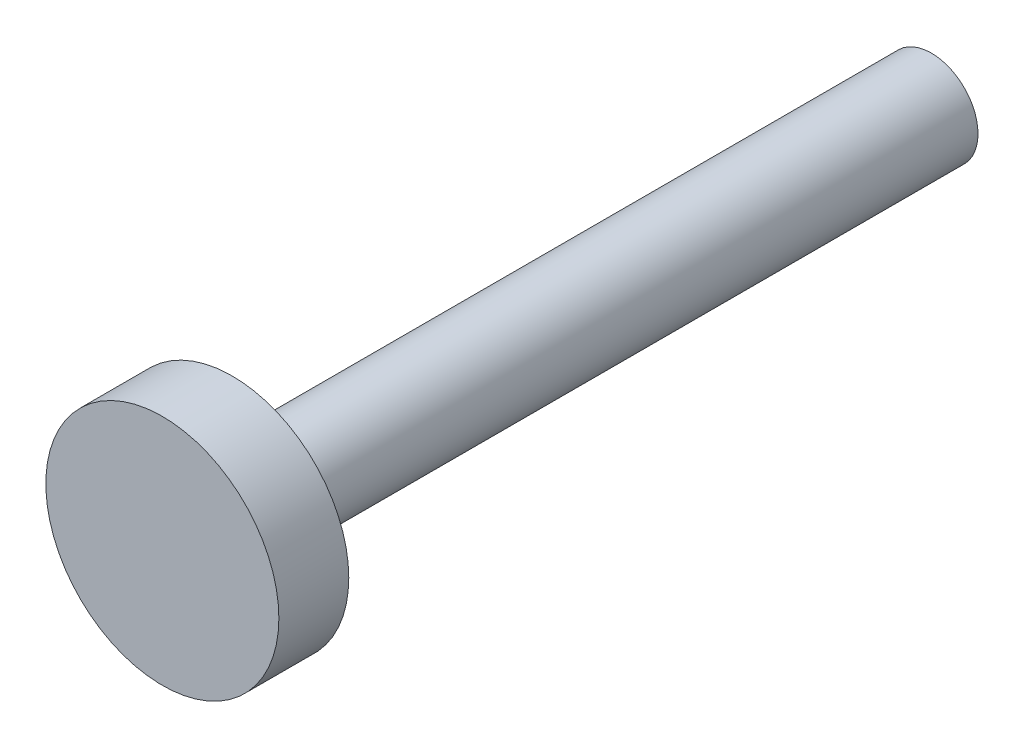
from build123d import *

# Parameters (mm, degrees)
SKETCH_1_R      = 2
EXTRUDE_1_DEPTH = 30
SKETCH_2_R      = 5
EXTRUDE_2_DEPTH = 3


with BuildPart() as part:
    # 스케치1 → 보스-돌출1 (new body)
    with BuildSketch(Plane.XY):
        Circle(SKETCH_1_R)
    extrude(amount=EXTRUDE_1_DEPTH)

    # 스케치2 → 보스-돌출2 (add)
    with BuildSketch(Plane.XY.offset(30)):
        Circle(SKETCH_2_R)
    extrude(amount=EXTRUDE_2_DEPTH)


solid = part.part
